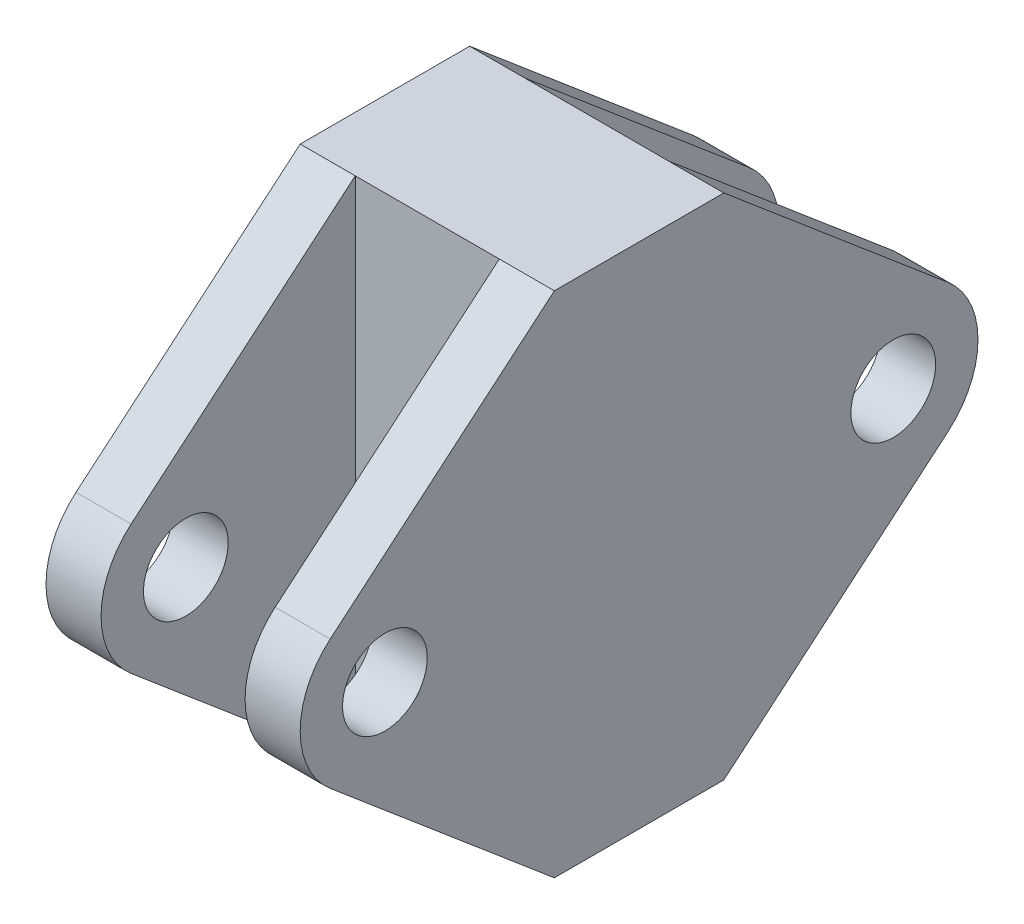
from build123d import *

# Parameters (mm, degrees)
SKETCH1_R           = 5
BOSS_EXTRUDE1_DEPTH = 15
SKETCH3_W           = 30
SKETCH3_H           = 60
CUT_EXTRUDE2_DEPTH  = 8.5


with BuildPart() as part:
    # Sketch1 → Boss-Extrude1 (new, symmetric)
    with BuildSketch(Plane(origin=(0, 0, 0), x_dir=(0, 0, -1), z_dir=(1, 0, 0))):
        with BuildLine():
            Line((-10, 30), (10, 30))
            Line((10, 30), (36.455619112, 7.637079408))
            ThreePointArc((36.455619112, 7.637079408), (40, 0), (36.455619112, -7.637079408))
            Line((36.455619112, -7.637079408), (10, -30))
            Line((10, -30), (-10, -30))
            Line((-10, -30), (-36.455619112, -7.637079408))
            ThreePointArc((-36.455619112, -7.637079408), (-40, 0), (-36.455619112, 7.637079408))
            Line((-36.455619112, 7.637079408), (-10, 30))
        make_face()
        with Locations((-30, 0)):
            Circle(SKETCH1_R, mode=Mode.SUBTRACT)
        with Locations(Location((30, 0, 0), (0, 0, 180))):
            Circle(SKETCH1_R, mode=Mode.SUBTRACT)
    extrude(amount=BOSS_EXTRUDE1_DEPTH, both=True)

    # Sketch3 → Cut-Extrude2 (cut, symmetric)
    with BuildSketch(Plane(origin=(0, 0, 0), x_dir=(0, 0, -1), z_dir=(1, 0, 0))):
        with Locations((-25, 0)):
            Rectangle(SKETCH3_W, SKETCH3_H)
        with Locations((25, 0)):
            Rectangle(SKETCH3_W, SKETCH3_H)
    extrude(amount=CUT_EXTRUDE2_DEPTH, both=True, mode=Mode.SUBTRACT)


solid = part.part
